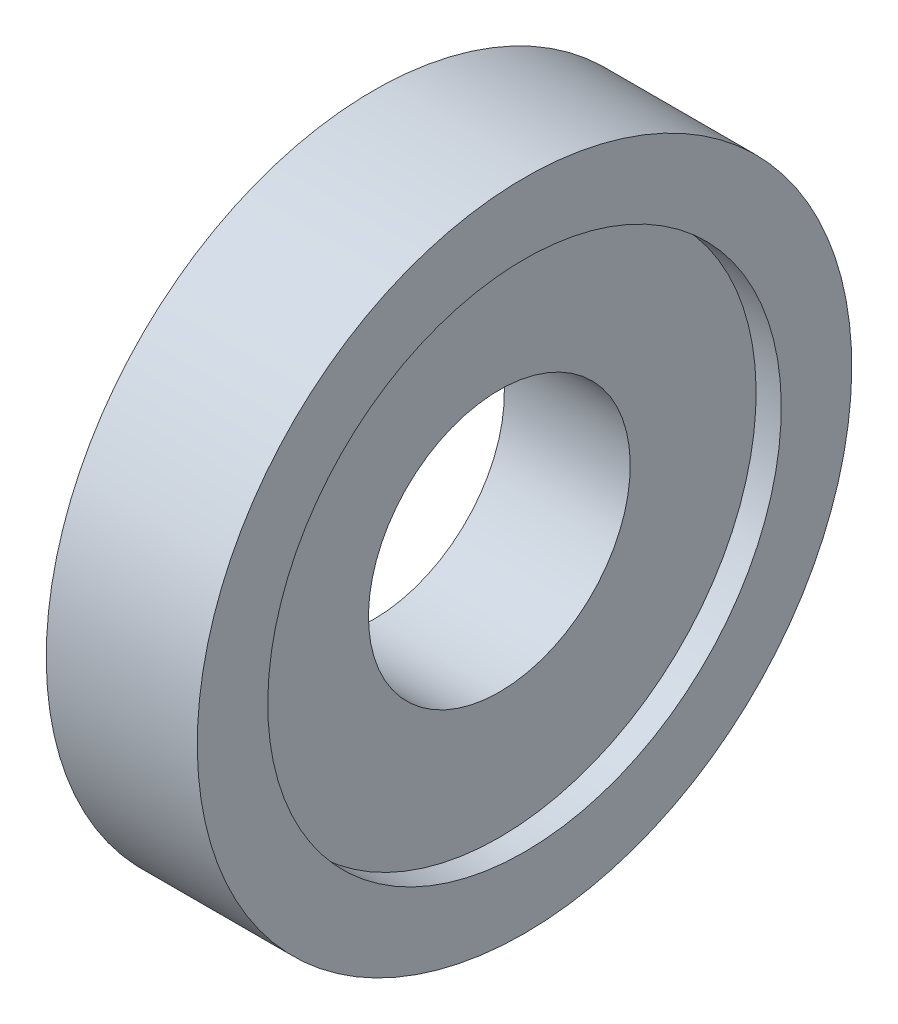
from build123d import *


with BuildPart() as part:
    # 草图1 → 旋转1 (revolve)
    with BuildSketch(Plane.XY, mode=Mode.PRIVATE) as revolve_1_sk:
        Polygon((0, 2.6), (0, 6.5), (3, 6.5), (3, 5.1), (2.5, 5.1), (2.5, 2.6), align=None)
    revolve(revolve_1_sk.sketch.rotate(Axis((0, 0, 0), (1, 0, 0)), 180), axis=Axis((0, 0, 0), (1, 0, 0)))


solid = part.part
